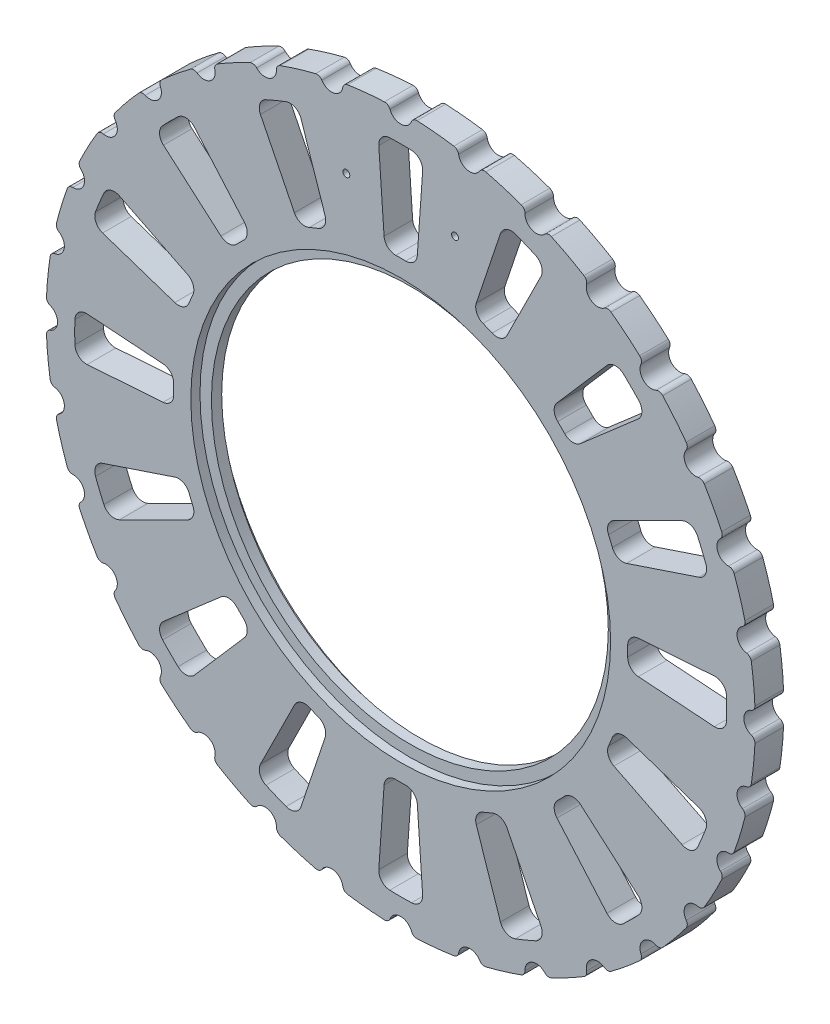
from build123d import *

# Parameters (mm, degrees)
SKETCH_1_R                       = 62
EXTRUDE_1_DEPTH                  = 5
SKETCH_1_3_R                     = 2
CUT_EXTRUDE_1_DEPTH              = 88.82368701
FILLET_1_R                       = 1
PATTERN_CIRCULAR_1_COUNT         = 32
FILLET_1_OF_PATTERN_CIRCULAR_1_R = 1
SKETCH_3_R                       = 34.7
CUT_EXTRUDE_2_DEPTH              = 88.732595739
SKETCH_4_R                       = 36.7
CUT_EXTRUDE_3_DEPTH              = 1.6
CUT_EXTRUDE_START                = -3.4
SKETCH_4_2_R                     = 36.7
CUT_EXTRUDE_5_DEPTH              = 1.6
CUT_EXTRUDE_7_DEPTH              = 88.732595739
FILLET_3_R                       = 2
FILLET_4_R                       = 2
PATTERN_CIRCULAR_2_COUNT         = 16
FILLET_3_OF_PATTERN_CIRCULAR_2_R = 2
FILLET_4_OF_PATTERN_CIRCULAR_2_R = 2
SKETCH_9_R                       = 0.6
CUT_EXTRUDE_8_DEPTH              = 88.732595739


with BuildPart() as part:
    # 草图1 → 凸台-拉伸1 (new body)
    with BuildSketch(Plane.XY):
        Circle(SKETCH_1_R)
    extrude(amount=EXTRUDE_1_DEPTH)

    # 草图1<3> → 切除-拉伸1 (cut, through all)
    with BuildSketch(Plane.XY):
        with Locations((0, 62)):
            Circle(SKETCH_1_3_R)
    cut_extrude_1 = extrude(amount=CUT_EXTRUDE_1_DEPTH, mode=Mode.SUBTRACT)

    # 圆角1
    fillet_1_edges = [part.edges().sort_by_distance(p)[0] for p in [
        (1.999739837, 61.967741935, 2.5),
        (-1.999739837, 61.967741935, 2.5),
    ]]
    fillet(fillet_1_edges, radius=FILLET_1_R)

    # 阵列(圆周)1: 切除-拉伸1 ×32 about axis
    pattern_circular_1_axis = Axis((0, 0, 0), (0, 0, 1))
    for i in range(1, PATTERN_CIRCULAR_1_COUNT):
        add(cut_extrude_1.rotate(pattern_circular_1_axis, i * 360 / PATTERN_CIRCULAR_1_COUNT), mode=Mode.SUBTRACT)

    # 圆角1 of 阵列(圆周)1
    fillet_1_of_pattern_circular_1_edges = [part.edges().sort_by_distance(p)[0] for p in [
        (-10.127991332, 61.167179039, 2.5),
        (-14.050622126, 60.386919261, 2.5),
        (-21.866509474, 58.015995755, 2.5),
        (-25.561546886, 56.485461145, 2.5),
        (-32.764709919, 52.63529029, 2.5),
        (-36.090155734, 50.413298435, 2.5),
        (-42.403780938, 45.231840137, 2.5),
        (-45.231840137, 42.403780938, 2.5),
        (-50.413298435, 36.090155734, 2.5),
        (-52.63529029, 32.764709919, 2.5),
        (-56.485461145, 25.561546886, 2.5),
        (-58.015995755, 21.866509474, 2.5),
        (-60.386919261, 14.050622126, 2.5),
        (-61.167179039, 10.127991332, 2.5),
        (-61.967741935, 1.999739837, 2.5),
        (-61.967741935, -1.999739837, 2.5),
        (-61.167179039, -10.127991332, 2.5),
        (-60.386919261, -14.050622126, 2.5),
        (-58.015995755, -21.866509474, 2.5),
        (-56.485461145, -25.561546886, 2.5),
        (-52.63529029, -32.764709919, 2.5),
        (-50.413298435, -36.090155734, 2.5),
        (-45.231840137, -42.403780938, 2.5),
        (-42.403780938, -45.231840137, 2.5),
        (-36.090155734, -50.413298435, 2.5),
        (-32.764709919, -52.63529029, 2.5),
        (-25.561546886, -56.485461145, 2.5),
        (-21.866509474, -58.015995755, 2.5),
        (-14.050622126, -60.386919261, 2.5),
        (-10.127991332, -61.167179039, 2.5),
        (-1.999739837, -61.967741935, 2.5),
        (1.999739837, -61.967741935, 2.5),
        (10.127991332, -61.167179039, 2.5),
        (14.050622126, -60.386919261, 2.5),
        (21.866509474, -58.015995755, 2.5),
        (25.561546886, -56.485461145, 2.5),
        (32.764709919, -52.63529029, 2.5),
        (36.090155734, -50.413298435, 2.5),
        (42.403780938, -45.231840137, 2.5),
        (45.231840137, -42.403780938, 2.5),
        (50.413298435, -36.090155734, 2.5),
        (52.63529029, -32.764709919, 2.5),
        (56.485461145, -25.561546886, 2.5),
        (58.015995755, -21.866509474, 2.5),
        (60.386919261, -14.050622126, 2.5),
        (61.167179039, -10.127991332, 2.5),
        (61.967741935, -1.999739837, 2.5),
        (61.967741935, 1.999739837, 2.5),
        (61.167179039, 10.127991332, 2.5),
        (60.386919261, 14.050622126, 2.5),
        (58.015995755, 21.866509474, 2.5),
        (56.485461145, 25.561546886, 2.5),
        (52.63529029, 32.764709919, 2.5),
        (50.413298435, 36.090155734, 2.5),
        (45.231840137, 42.403780938, 2.5),
        (42.403780938, 45.231840137, 2.5),
        (36.090155734, 50.413298435, 2.5),
        (32.764709919, 52.63529029, 2.5),
        (25.561546886, 56.485461145, 2.5),
        (21.866509474, 58.015995755, 2.5),
        (14.050622126, 60.386919261, 2.5),
        (10.127991332, 61.167179039, 2.5),
    ]]
    fillet(fillet_1_of_pattern_circular_1_edges, radius=FILLET_1_OF_PATTERN_CIRCULAR_1_R)

    # 草图3 → 切除-拉伸2 (cut, through all)
    with BuildSketch(Plane(origin=(0, 0, 0), x_dir=(-1, 0, 0), z_dir=(0, 0, -1))):
        Circle(SKETCH_3_R)
    extrude(amount=-CUT_EXTRUDE_2_DEPTH, mode=Mode.SUBTRACT)

    # 草图4 → 切除-拉伸3 (cut)
    with BuildSketch(Plane(origin=(0, 0, 0), x_dir=(-1, 0, 0), z_dir=(0, 0, -1))):
        Circle(SKETCH_4_R)
    extrude(amount=-CUT_EXTRUDE_3_DEPTH, mode=Mode.SUBTRACT)

    # 草图4<2> → 切除-拉伸5 (cut)
    with BuildSketch(Plane(origin=(0, 0, 0), x_dir=(-1, 0, 0), z_dir=(0, 0, -1)).offset(CUT_EXTRUDE_START)):
        Circle(SKETCH_4_2_R)
    extrude(amount=-CUT_EXTRUDE_5_DEPTH, mode=Mode.SUBTRACT)

    # 草图8 → 切除-拉伸7 (cut, symmetric)
    with BuildSketch(Plane(origin=(0, 0, 0), x_dir=(-1, 0, 0), z_dir=(0, 0, -1))):
        with BuildLine():
            ThreePointArc((2.769332008, -39.603292795), (0, -39.7), (-2.769332008, -39.603292795))
            Line((-2.769332008, -39.603292795), (-3.976119003, -56.861150865))
            ThreePointArc((-3.976119003, -56.861150865), (0, -57), (3.976119003, -56.861150865))
            Line((3.976119003, -56.861150865), (2.769332008, -39.603292795))
        make_face()
    cut_extrude_7 = extrude(amount=CUT_EXTRUDE_7_DEPTH, both=True, mode=Mode.SUBTRACT)

    # 圆角3
    fillet_3_edges = [part.edges().sort_by_distance(p)[0] for p in [
        (-3.976119003, -56.861150865, 2.5),
        (3.976119003, -56.861150865, 2.5),
    ]]
    fillet(fillet_3_edges, radius=FILLET_3_R)

    # 圆角4
    fillet_4_edges = [part.edges().sort_by_distance(p)[0] for p in [
        (2.769332008, -39.603292795, 2.5),
        (-2.769332008, -39.603292795, 2.5),
    ]]
    fillet(fillet_4_edges, radius=FILLET_4_R)

    # 阵列(圆周)2: 切除-拉伸7 ×16 about axis
    pattern_circular_2_axis = Axis((0, 0, 0), (0, 0, 1))
    for i in range(1, PATTERN_CIRCULAR_2_COUNT):
        add(cut_extrude_7.rotate(pattern_circular_2_axis, i * 360 / PATTERN_CIRCULAR_2_COUNT), mode=Mode.SUBTRACT)

    # 圆角3 of 阵列(圆周)2
    fillet_3_of_pattern_circular_2_edges = [part.edges().sort_by_distance(p)[0] for p in [
        (18.086365415, -54.054448347, 2.5),
        (25.433275347, -51.011258611, 2.5),
        (37.395364652, -43.018446073, 2.5),
        (43.018446073, -37.395364652, 2.5),
        (51.011258611, -25.433275347, 2.5),
        (54.054448347, -18.086365415, 2.5),
        (56.861150865, -3.976119003, 2.5),
        (56.861150865, 3.976119003, 2.5),
        (54.054448347, 18.086365415, 2.5),
        (51.011258611, 25.433275347, 2.5),
        (43.018446073, 37.395364652, 2.5),
        (37.395364652, 43.018446073, 2.5),
        (25.433275347, 51.011258611, 2.5),
        (18.086365415, 54.054448347, 2.5),
        (3.976119003, 56.861150865, 2.5),
        (-3.976119003, 56.861150865, 2.5),
        (-18.086365415, 54.054448347, 2.5),
        (-25.433275347, 51.011258611, 2.5),
        (-37.395364652, 43.018446073, 2.5),
        (-43.018446073, 37.395364652, 2.5),
        (-51.011258611, 25.433275347, 2.5),
        (-54.054448347, 18.086365415, 2.5),
        (-56.861150865, 3.976119003, 2.5),
        (-56.861150865, -3.976119003, 2.5),
        (-54.054448347, -18.086365415, 2.5),
        (-51.011258611, -25.433275347, 2.5),
        (-43.018446073, -37.395364652, 2.5),
        (-37.395364652, -43.018446073, 2.5),
        (-25.433275347, -51.011258611, 2.5),
        (-18.086365415, -54.054448347, 2.5),
    ]]
    fillet(fillet_3_of_pattern_circular_2_edges, radius=FILLET_3_OF_PATTERN_CIRCULAR_2_R)

    # 圆角4 of 阵列(圆周)2
    fillet_4_of_pattern_circular_2_edges = [part.edges().sort_by_distance(p)[0] for p in [
        (17.71405318, -35.528894156, 2.5),
        (12.596994859, -37.648449112, 2.5),
        (29.961970335, -26.045543451, 2.5),
        (26.045543451, -29.961970335, 2.5),
        (37.648449112, -12.596994859, 2.5),
        (35.528894156, -17.71405318, 2.5),
        (39.603292795, 2.769332008, 2.5),
        (39.603292795, -2.769332008, 2.5),
        (35.528894156, 17.71405318, 2.5),
        (37.648449112, 12.596994859, 2.5),
        (26.045543451, 29.961970335, 2.5),
        (29.961970335, 26.045543451, 2.5),
        (12.596994859, 37.648449112, 2.5),
        (17.71405318, 35.528894156, 2.5),
        (-2.769332008, 39.603292795, 2.5),
        (2.769332008, 39.603292795, 2.5),
        (-17.71405318, 35.528894156, 2.5),
        (-12.596994859, 37.648449112, 2.5),
        (-29.961970335, 26.045543451, 2.5),
        (-26.045543451, 29.961970335, 2.5),
        (-37.648449112, 12.596994859, 2.5),
        (-35.528894156, 17.71405318, 2.5),
        (-39.603292795, -2.769332008, 2.5),
        (-39.603292795, 2.769332008, 2.5),
        (-35.528894156, -17.71405318, 2.5),
        (-37.648449112, -12.596994859, 2.5),
        (-26.045543451, -29.961970335, 2.5),
        (-29.961970335, -26.045543451, 2.5),
        (-12.596994859, -37.648449112, 2.5),
        (-17.71405318, -35.528894156, 2.5),
    ]]
    fillet(fillet_4_of_pattern_circular_2_edges, radius=FILLET_4_OF_PATTERN_CIRCULAR_2_R)

    # 草图9 → 切除-拉伸8 (cut, through all)
    with BuildSketch(Plane(origin=(0, 0, 0), x_dir=(-1, 0, 0), z_dir=(0, 0, -1))):
        with Locations((-9.5, 47.759725175)):
            Circle(SKETCH_9_R)
        with Locations((9.5, 47.759725175)):
            Circle(SKETCH_9_R)
    extrude(amount=-CUT_EXTRUDE_8_DEPTH, mode=Mode.SUBTRACT)


solid = part.part
